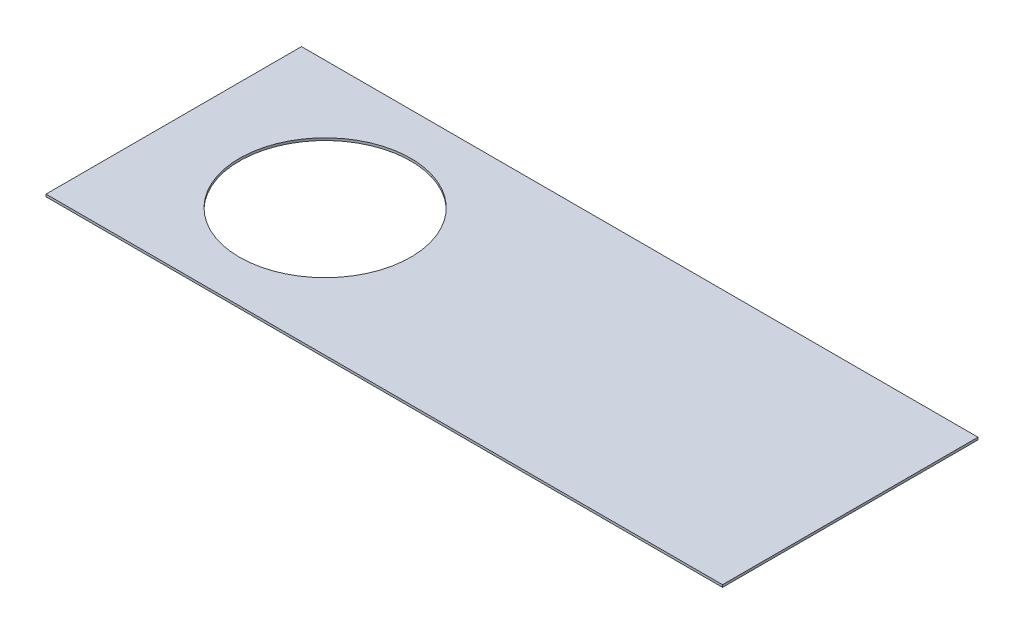
from build123d import *

# Parameters (mm, degrees)
SKETCH1_W           = 454.025
SKETCH1_H           = 171.45
BOSS_EXTRUDE1_DEPTH = 1.5875
SKETCH7_R           = 57.5
CUT_EXTRUDE4_DEPTH  = 486.320845711


with BuildPart() as part:
    # Sketch1 → Boss-Extrude1 (new body)
    with BuildSketch(Plane(origin=(0, 0, 0), x_dir=(1, 0, 0), z_dir=(0, 1, 0))):
        with Locations((227.0125, 85.725)):
            Rectangle(SKETCH1_W, SKETCH1_H)
    extrude(amount=BOSS_EXTRUDE1_DEPTH)

    # Sketch7 → Cut-Extrude4 (cut, through all)
    with BuildSketch(Plane(origin=(0, 1.5875, 0), x_dir=(1, 0, 0), z_dir=(0, 1, 0))):
        with Locations(Location((101.6, 85.725, 0), (0, 0, 270))):
            Circle(SKETCH7_R)
    extrude(amount=-CUT_EXTRUDE4_DEPTH, mode=Mode.SUBTRACT)


solid = part.part
